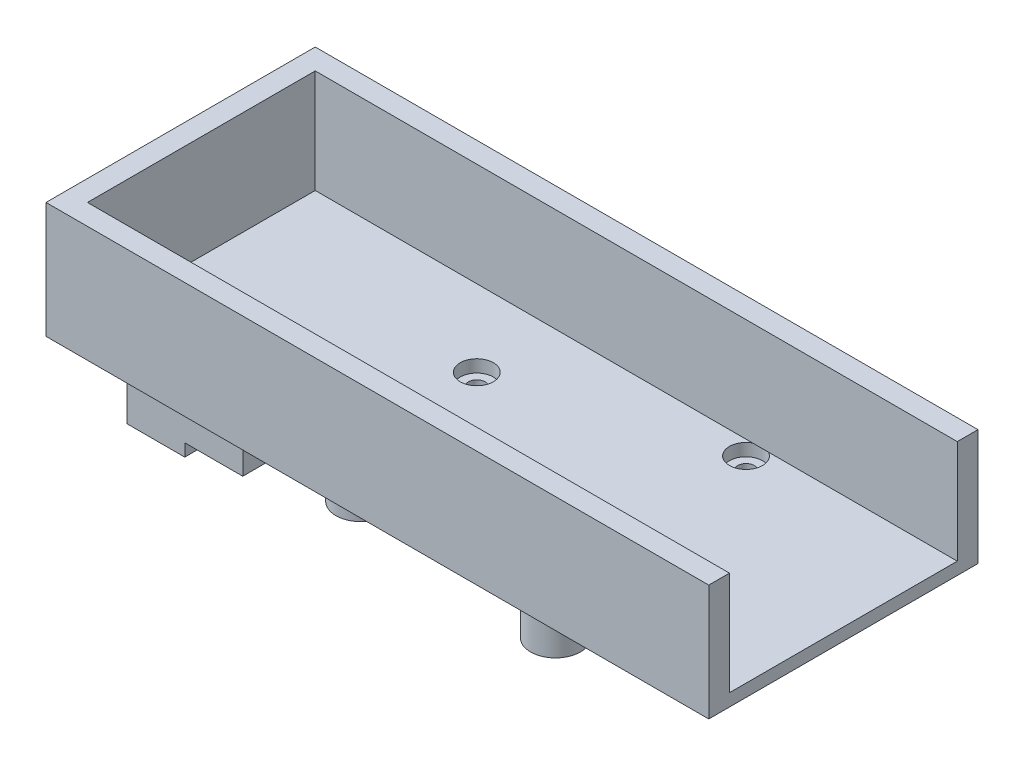
from build123d import *

# Parameters (mm, degrees)
SKETCH1_R                                = 6
SKETCH1_R_2                              = 2
ARDUINO_OFFSET_PINS_DEPTH                = 10
ARDUINO_OFFSET_PINS_2_DEPTH              = 10
ARDUINO_OFFSET_PINS_3_DEPTH              = 10
ARDUINO_OFFSET_PINS_4_DEPTH              = 10
SKETCH2_W                                = 160
SKETCH2_H                                = 65
SKETCH2_R                                = 2
BATTERY_HOLDER_BASE_DEPTH                = 3
SKETCH3_R                                = 4
BATTERY_HOLDER_ARDUINO_COUNTERSINK_DEPTH = 3
BATTERYHOLDER_WALLS_DEPTH                = 25
SEEED_HOLDER_WALLS_DEPTH                 = 25
SEEED_HOLDER_CAP_DEPTH                   = 3


with BuildPart() as part:
    # Sketch1 → Arduino Offset Pins (new body)
    with BuildSketch(Plane(origin=(0, 0, 0), x_dir=(1, 0, 0), z_dir=(0, 1, 0))):
        with Locations(Location((0, 28, 0), (0, 0, 270))):
            Circle(SKETCH1_R)
        with Locations(Location((0, 28, 0), (0, 0, 270))):
            Circle(SKETCH1_R_2, mode=Mode.SUBTRACT)
    extrude(amount=ARDUINO_OFFSET_PINS_DEPTH)



with BuildPart() as body_2:
    # Sketch1 → Arduino Offset Pins 2 (new body)
    with BuildSketch(Plane(origin=(0, 0, 0), x_dir=(1, 0, 0), z_dir=(0, 1, 0))):
        with Locations(Location((0, 0, 0), (0, 0, 270))):
            Circle(SKETCH1_R)
        with Locations(Location((0, 0, 0), (0, 0, 270))):
            Circle(SKETCH1_R_2, mode=Mode.SUBTRACT)
    extrude(amount=ARDUINO_OFFSET_PINS_2_DEPTH)


with BuildPart() as body_3:
    # Sketch1 → Arduino Offset Pins 3 (new body)
    with BuildSketch(Plane(origin=(0, 0, 0), x_dir=(1, 0, 0), z_dir=(0, 1, 0))):
        with Locations(Location((52, -5, 0), (0, 0, 270))):
            Circle(SKETCH1_R)
        with Locations(Location((52, -5, 0), (0, 0, 270))):
            Circle(SKETCH1_R_2, mode=Mode.SUBTRACT)
    extrude(amount=ARDUINO_OFFSET_PINS_3_DEPTH)


with BuildPart() as body_4:
    # Sketch1 → Arduino Offset Pins 4 (new body)
    with BuildSketch(Plane(origin=(0, 0, 0), x_dir=(1, 0, 0), z_dir=(0, 1, 0))):
        with Locations(Location((50, 43, 0), (0, 0, 270))):
            Circle(SKETCH1_R)
        with Locations(Location((50, 43, 0), (0, 0, 270))):
            Circle(SKETCH1_R_2, mode=Mode.SUBTRACT)
    extrude(amount=ARDUINO_OFFSET_PINS_4_DEPTH)


with BuildPart() as part_1:
    add(part.part)

    add(body_2.part)  # battery holder base merges body 2

    add(body_3.part)  # battery holder base merges body 3

    add(body_4.part)  # battery holder base merges body 4
    # Sketch2 → battery holder base (add)
    with BuildSketch(Plane(origin=(0, 10, 0), x_dir=(1, 0, 0), z_dir=(0, 1, 0))):
        with Locations((17.5, 19)):
            Rectangle(SKETCH2_W, SKETCH2_H)
        with Locations(Location((0, 0, 0), (0, 0, 270))):
            Circle(SKETCH2_R, mode=Mode.SUBTRACT)
        with Locations(Location((0, 28, 0), (0, 0, 270))):
            Circle(SKETCH2_R, mode=Mode.SUBTRACT)
        with Locations(Location((50, 43, 0), (0, 0, 270))):
            Circle(SKETCH2_R, mode=Mode.SUBTRACT)
        with Locations(Location((52, -5, 0), (0, 0, 270))):
            Circle(SKETCH2_R, mode=Mode.SUBTRACT)
    extrude(amount=BATTERY_HOLDER_BASE_DEPTH)

    # Sketch3 → Battery Holder Arduino Countersink (cut)
    with BuildSketch(Plane(origin=(0, 13, 0), x_dir=(1, 0, 0), z_dir=(0, 1, 0))):
        with Locations(Location((0, 0, 0), (0, 0, 270))):
            Circle(SKETCH3_R)
        with Locations(Location((0, 28, 0), (0, 0, 270))):
            Circle(SKETCH3_R)
        with Locations(Location((52, -5, 0), (0, 0, 270))):
            Circle(SKETCH3_R)
        with Locations(Location((50, 43, 0), (0, 0, 270))):
            Circle(SKETCH3_R)
    extrude(amount=-BATTERY_HOLDER_ARDUINO_COUNTERSINK_DEPTH, mode=Mode.SUBTRACT)

    # Sketch4 → BatteryHolder Walls (add)
    with BuildSketch(Plane(origin=(0, 13, 0), x_dir=(1, 0, 0), z_dir=(0, 1, 0))):
        Polygon((-62.5, -13.5), (97.5, -13.5), (97.5, -8.5), (-57.5, -8.5), (-57.5, 46.5), (97.5, 46.5), (97.5, 51.5), (-62.5, 51.5), (-62.5, 46.5), (-62.5, -8.5), align=None)
    extrude(amount=BATTERYHOLDER_WALLS_DEPTH)

    # Sketch6 → SEEED holder walls (add)
    with BuildSketch(Plane.XZ.offset(-10)):
        Polygon((-34.5, -32), (-34.5, -6), (-62.5, -6), (-62.5, -9), (-37.5, -9), (-37.5, -29), (-62.5, -29), (-62.5, -32), align=None)
        Polygon((-43.5, -19), (-43.5, -15.658875471), (-46.5, -15.658875471), (-46.5, -19), (-46.5, -22.341124529), (-43.5, -22.341124529), align=None)
    extrude(amount=SEEED_HOLDER_WALLS_DEPTH)

    # Sketch7 → Seeed holder cap (add)
    with BuildSketch(Plane.XZ.offset(15)):
        Polygon((-48.5, -15.658875471), (-48.5, -6), (-62.5, -6), (-62.5, -32), (-48.5, -32), (-48.5, -22.341124529), (-43.5, -22.341124529), (-43.5, -15.658875471), align=None)
    extrude(amount=SEEED_HOLDER_CAP_DEPTH)


solid = part_1.part
